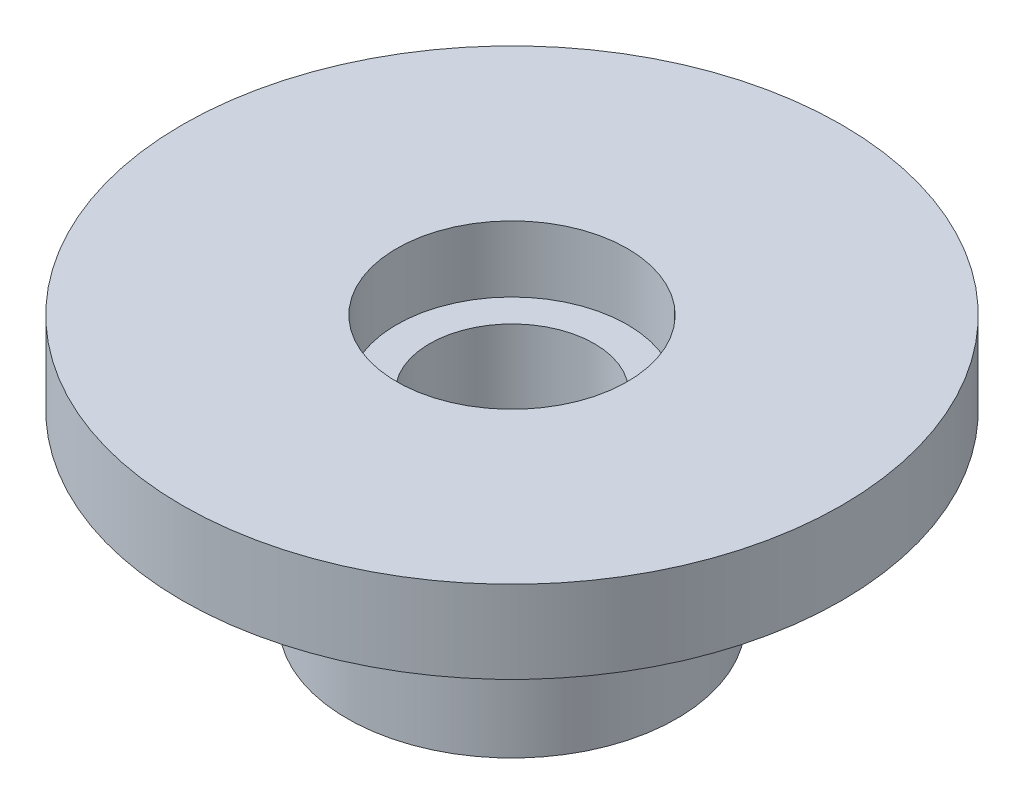
from build123d import *


with BuildPart() as part:
    # Sketch1 → Revolve1 (revolve)
    with BuildSketch(Plane.XY, mode=Mode.PRIVATE) as revolve1_sk:
        Polygon((2.5, 6.1), (3.5, 6.1), (3.5, 8.1), (10, 8.1), (10, 5.6), (5, 5.6), (5, 0), (2.5, 0), align=None)
    revolve(revolve1_sk.sketch.rotate(Axis((0, 0, 0), (0, 1, 0)), 90), axis=Axis((0, 0, 0), (0, 1, 0)))


solid = part.part
